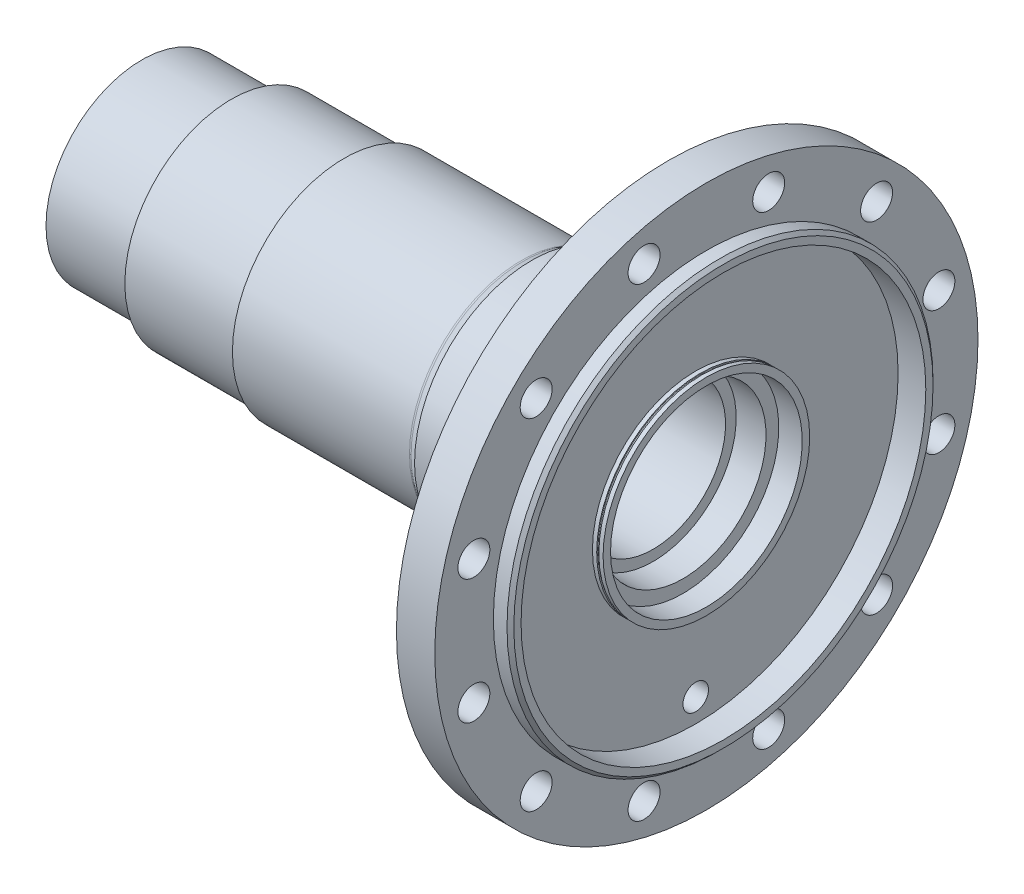
from build123d import *

# Parameters (mm, degrees)
SKETCH_3_W           = 2
SKETCH_3_H           = 46.5
SKETCH_5_W           = 2
SKETCH_5_H           = 46.5
SKETCH_6_R           = 7.5
CUT_EXTRUDE_1_DEPTH  = 328.171973127
SKETCH_7_R           = 7.5
CUT_EXTRUDE_2_DEPTH  = 328.171973127
SKETCH_8_R           = 7.5
CUT_EXTRUDE_3_DEPTH  = 328.171973127
SKETCH_9_R           = 7.5
CUT_EXTRUDE_4_DEPTH  = 328.171973127
SKETCH_10_R          = 7.5
CUT_EXTRUDE_5_DEPTH  = 328.171973127
SKETCH_11_R          = 7.5
CUT_EXTRUDE_6_DEPTH  = 328.171973127
SKETCH_12_R          = 7.5
CUT_EXTRUDE_7_DEPTH  = 328.171973127
SKETCH_13_R          = 7.5
CUT_EXTRUDE_8_DEPTH  = 328.171973127
SKETCH_14_R          = 7.5
CUT_EXTRUDE_9_DEPTH  = 328.171973127
SKETCH_15_R          = 7.5
CUT_EXTRUDE_10_DEPTH = 328.171973127
SKETCH_16_R          = 7.5
CUT_EXTRUDE_11_DEPTH = 328.171973127
SKETCH_17_R          = 7.5
CUT_EXTRUDE_12_DEPTH = 328.171973127
SKETCH_18_R          = 6
CUT_EXTRUDE_13_DEPTH = 328.171973127


with BuildPart() as part:
    # Эскиз1 → Повернуть1 (revolve)
    with BuildSketch(Plane.XY, mode=Mode.PRIVATE) as revolve_1_sk:
        with BuildLine():
            Line((0, 0), (273, 0))
            Line((273, 0), (273, 98.4))
            Line((273, 98.4), (271.4, 100))
            Line((271.4, 100), (265, 100))
            Line((265, 100), (265, 127.5))
            Line((265, 127.5), (247, 127.5))
            Line((247, 127.5), (247, 100))
            Line((247, 100), (239, 100))
            Line((239, 100), (239, 64.5))
            ThreePointArc((239, 64.5), (238.414213562, 63.085786438), (237, 62.5))
            Line((237, 62.5), (218, 62.5))
            Line((218, 62.5), (215, 60.767949192))
            Line((215, 60.767949192), (215, 57))
            ThreePointArc((215, 57), (214.414213562, 55.585786438), (213, 55))
            Line((213, 55), (183, 55))
            Line((183, 55), (179.133974596, 52.767949192))
            ThreePointArc((179.133974596, 52.767949192), (178.651612686, 52.568148347), (178.133974596, 52.5))
            Line((178.133974596, 52.5), (95, 52.5))
            Line((95, 52.5), (95, 50))
            Line((95, 50), (42, 50))
            Line((42, 50), (42, 45))
            Line((42, 45), (0, 45))
            Line((0, 45), (0, 0))
        make_face()
    revolve(revolve_1_sk.sketch.rotate(Axis((0, 0, 0), (1, 0, 0)), 90), axis=Axis((0, 0, 0), (1, 0, 0)))

    # Эскиз2 → Вырез-Повернуть1 (revolve, cut)
    with BuildSketch(Plane.XY, mode=Mode.PRIVATE) as cut_revolve_1_sk:
        Polygon((0, 0), (273, 0), (273, 95), (265, 95), (265, 45), (254, 45), (254, 39), (240, 39), (240, 34), (203.5, 34), (203.5, 31), (0, 31), align=None)
    revolve(cut_revolve_1_sk.sketch.rotate(Axis((0, 0, 0), (1, 0, 0)), 90), axis=Axis((0, 0, 0), (1, 0, 0)), mode=Mode.SUBTRACT)

    # Эскиз3 → Rear_recess_left (revolve, cut)
    with BuildSketch(Plane.XY, mode=Mode.PRIVATE) as rear_recess_left_sk:
        with Locations((261, 71.75)):
            Rectangle(SKETCH_3_W, SKETCH_3_H)
    revolve(rear_recess_left_sk.sketch.rotate(Axis((0, 0, 0), (1, 0, 0)), 90), axis=Axis((0, 0, 0), (1, 0, 0)), mode=Mode.SUBTRACT)

    # Эскиз4 → Collar_groove_nominal (revolve, cut)
    with BuildSketch(Plane.XY, mode=Mode.PRIVATE) as collar_groove_nominal_sk:
        with BuildLine():
            Line((263, 48), (263, 95))
            Line((263, 95), (262, 95))
            Line((262, 95), (262, 48))
            ThreePointArc((262, 48), (262.146446609, 47.646446609), (262.5, 47.5))
            ThreePointArc((262.5, 47.5), (262.853553391, 47.646446609), (263, 48))
        make_face()
    revolve(collar_groove_nominal_sk.sketch.rotate(Axis((0, 0, 0), (1, 0, 0)), 90), axis=Axis((0, 0, 0), (1, 0, 0)), mode=Mode.SUBTRACT)

    # Эскиз5 → Rear_recess_lip (revolve, cut)
    with BuildSketch(Plane.XY, mode=Mode.PRIVATE) as rear_recess_lip_sk:
        with Locations((264, 71.75)):
            Rectangle(SKETCH_5_W, SKETCH_5_H)
    revolve(rear_recess_lip_sk.sketch.rotate(Axis((0, 0, 0), (1, 0, 0)), 90), axis=Axis((0, 0, 0), (1, 0, 0)), mode=Mode.SUBTRACT)

    # Эскиз6 → Вырез-Вытянуть1 (cut, through all)
    with BuildSketch(Plane(origin=(0, 0, 0), x_dir=(0, 0, -1), z_dir=(1, 0, 0))):
        with Locations(Location((109.149618371, 29.246552097, 0), (0, 0, 180))):
            Circle(SKETCH_6_R)
    extrude(amount=CUT_EXTRUDE_1_DEPTH, mode=Mode.SUBTRACT)

    # Эскиз7 → Вырез-Вытянуть2 (cut, through all)
    with BuildSketch(Plane(origin=(0, 0, 0), x_dir=(0, 0, -1), z_dir=(1, 0, 0))):
        with Locations(Location((79.903066274, 79.903066274, 0), (0, 0, 180))):
            Circle(SKETCH_7_R)
    extrude(amount=CUT_EXTRUDE_2_DEPTH, mode=Mode.SUBTRACT)

    # Эскиз8 → Вырез-Вытянуть3 (cut, through all)
    with BuildSketch(Plane(origin=(0, 0, 0), x_dir=(0, 0, -1), z_dir=(1, 0, 0))):
        with Locations(Location((29.246552097, 109.149618371, 0), (0, 0, 180))):
            Circle(SKETCH_8_R)
    extrude(amount=CUT_EXTRUDE_3_DEPTH, mode=Mode.SUBTRACT)

    # Эскиз9 → Вырез-Вытянуть4 (cut, through all)
    with BuildSketch(Plane(origin=(0, 0, 0), x_dir=(0, 0, -1), z_dir=(1, 0, 0))):
        with Locations(Location((-29.246552097, 109.149618371, 0), (0, 0, 180))):
            Circle(SKETCH_9_R)
    extrude(amount=CUT_EXTRUDE_4_DEPTH, mode=Mode.SUBTRACT)

    # Эскиз10 → Вырез-Вытянуть5 (cut, through all)
    with BuildSketch(Plane(origin=(0, 0, 0), x_dir=(0, 0, -1), z_dir=(1, 0, 0))):
        with Locations(Location((-79.903066274, 79.903066274, 0), (0, 0, 180))):
            Circle(SKETCH_10_R)
    extrude(amount=CUT_EXTRUDE_5_DEPTH, mode=Mode.SUBTRACT)

    # Эскиз11 → Вырез-Вытянуть6 (cut, through all)
    with BuildSketch(Plane(origin=(0, 0, 0), x_dir=(0, 0, -1), z_dir=(1, 0, 0))):
        with Locations(Location((-109.149618371, 29.246552097, 0), (0, 0, 180))):
            Circle(SKETCH_11_R)
    extrude(amount=CUT_EXTRUDE_6_DEPTH, mode=Mode.SUBTRACT)

    # Эскиз12 → Вырез-Вытянуть7 (cut, through all)
    with BuildSketch(Plane(origin=(0, 0, 0), x_dir=(0, 0, -1), z_dir=(1, 0, 0))):
        with Locations(Location((-109.149618371, -29.246552097, 0), (0, 0, 180))):
            Circle(SKETCH_12_R)
    extrude(amount=CUT_EXTRUDE_7_DEPTH, mode=Mode.SUBTRACT)

    # Эскиз13 → Вырез-Вытянуть8 (cut, through all)
    with BuildSketch(Plane(origin=(0, 0, 0), x_dir=(0, 0, -1), z_dir=(1, 0, 0))):
        with Locations(Location((-79.903066274, -79.903066274, 0), (0, 0, 180))):
            Circle(SKETCH_13_R)
    extrude(amount=CUT_EXTRUDE_8_DEPTH, mode=Mode.SUBTRACT)

    # Эскиз14 → Вырез-Вытянуть9 (cut, through all)
    with BuildSketch(Plane(origin=(0, 0, 0), x_dir=(0, 0, -1), z_dir=(1, 0, 0))):
        with Locations(Location((-29.246552097, -109.149618371, 0), (0, 0, 180))):
            Circle(SKETCH_14_R)
    extrude(amount=CUT_EXTRUDE_9_DEPTH, mode=Mode.SUBTRACT)

    # Эскиз15 → Вырез-Вытянуть10 (cut, through all)
    with BuildSketch(Plane(origin=(0, 0, 0), x_dir=(0, 0, -1), z_dir=(1, 0, 0))):
        with Locations(Location((29.246552097, -109.149618371, 0), (0, 0, 180))):
            Circle(SKETCH_15_R)
    extrude(amount=CUT_EXTRUDE_10_DEPTH, mode=Mode.SUBTRACT)

    # Эскиз16 → Вырез-Вытянуть11 (cut, through all)
    with BuildSketch(Plane(origin=(0, 0, 0), x_dir=(0, 0, -1), z_dir=(1, 0, 0))):
        with Locations(Location((79.903066274, -79.903066274, 0), (0, 0, 180))):
            Circle(SKETCH_16_R)
    extrude(amount=CUT_EXTRUDE_11_DEPTH, mode=Mode.SUBTRACT)

    # Эскиз17 → Вырез-Вытянуть12 (cut, through all)
    with BuildSketch(Plane(origin=(0, 0, 0), x_dir=(0, 0, -1), z_dir=(1, 0, 0))):
        with Locations(Location((109.149618371, -29.246552097, 0), (0, 0, 180))):
            Circle(SKETCH_17_R)
    extrude(amount=CUT_EXTRUDE_12_DEPTH, mode=Mode.SUBTRACT)

    # Эскиз18 → Вырез-Вытянуть13 (cut, through all)
    with BuildSketch(Plane(origin=(0, 0, 0), x_dir=(0, 0, -1), z_dir=(1, 0, 0))):
        with Locations((0, -84)):
            Circle(SKETCH_18_R)
    extrude(amount=CUT_EXTRUDE_13_DEPTH, mode=Mode.SUBTRACT)


solid = part.part
